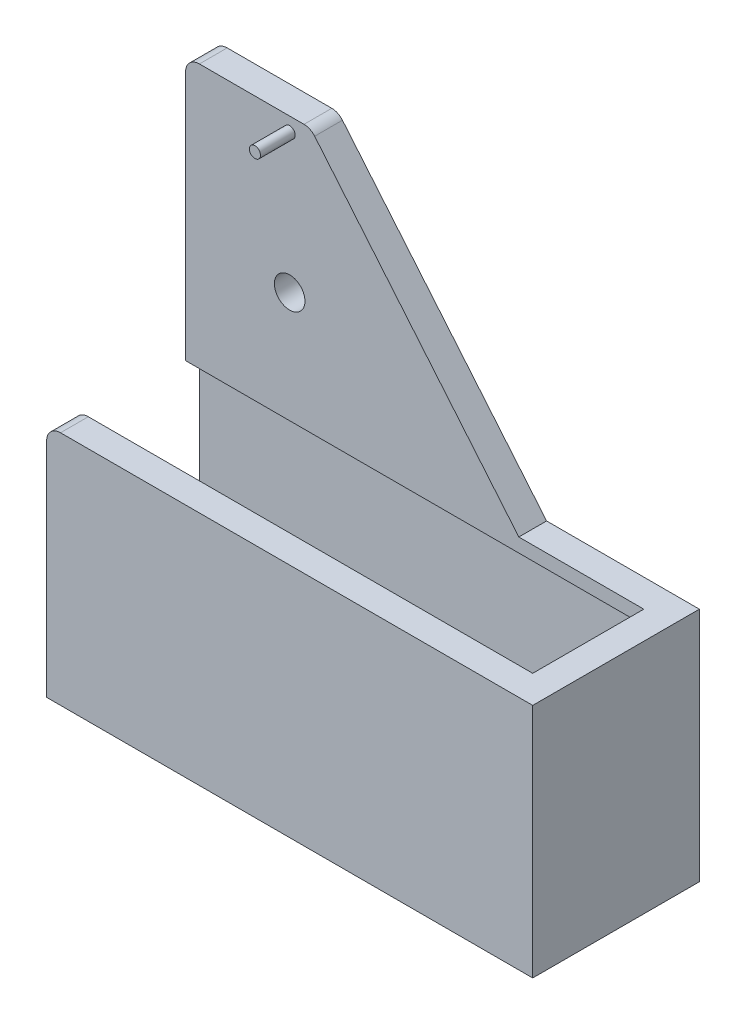
from build123d import *

# Parameters (mm, degrees)
SKETCH1_W           = 330
SKETCH1_H           = 120
BOSS_EXTRUDE1_DEPTH = 120
SKETCH2_W           = 100
SKETCH2_H           = 100
CUT_EXTRUDE1_DEPTH  = 357.230262611
CUT_EXTRUDE2_REACH  = 214.662
SKETCH5_W           = 330
SKETCH5_H           = 80
SKETCH6_W           = 40
SKETCH6_H           = 20
BOSS_EXTRUDE2_DEPTH = 180
SKETCH9_R           = 4
BOSS_EXTRUDE3_DEPTH = 25
SKETCH11_W          = 20
SKETCH11_H          = 120
EXTRUDE_THIN1_DEPTH = 120
CUT_EXTRUDE3_REACH  = 359.526
SKETCH12_W          = 30
SKETCH12_H          = 100
EXTRUDE_THIN2_DEPTH = 50
BOSS_EXTRUDE5_DEPTH = 20
FILLET1_R           = 10
SKETCH9_4_R         = 11
CUT_EXTRUDE4_DEPTH  = 367.367302034
SKETCH17_W          = 50
SKETCH17_H          = 20
BOSS_EXTRUDE6_DEPTH = 180
FILLET6_R           = 10


with BuildPart() as part:
    # Sketch1 → Boss-Extrude1 (new body)
    with BuildSketch(Plane(origin=(0, 0, 0), x_dir=(1, 0, 0), z_dir=(0, 1, 0))):
        Rectangle(SKETCH1_W, SKETCH1_H)
    extrude(amount=BOSS_EXTRUDE1_DEPTH)

    # Sketch2 → Cut-Extrude1 (cut, through all)
    with BuildSketch(Plane(origin=(165, 0, 0), x_dir=(0, 0, -1), z_dir=(1, 0, 0))):
        with Locations((0, 60)):
            Rectangle(SKETCH2_W, SKETCH2_H)
    extrude(amount=-CUT_EXTRUDE1_DEPTH, mode=Mode.SUBTRACT)

    # Sketch5 → Cut-Extrude2 (cut, up to next)
    with BuildSketch(Plane(origin=(0, 120, 0), x_dir=(1, 0, 0), z_dir=(0, 1, 0)), mode=Mode.PRIVATE) as cut_extrude2_sk1:
        Rectangle(SKETCH5_W, SKETCH5_H)
    cut_extrude2_tool1 = extrude(cut_extrude2_sk1.sketch, amount=-CUT_EXTRUDE2_REACH, mode=Mode.PRIVATE) & part.part
    add(cut_extrude2_tool1.solids().sort_by_distance((0, 120, 0))[0], mode=Mode.SUBTRACT)

    # Sketch6 → Boss-Extrude2 (add)
    with BuildSketch(Plane(origin=(0, 120, 0), x_dir=(1, 0, 0), z_dir=(0, 1, 0))):
        with Locations((-95, 50)):
            Rectangle(SKETCH6_W, SKETCH6_H)
    extrude(amount=BOSS_EXTRUDE2_DEPTH)

    # Sketch9 → Boss-Extrude3 (add)
    with BuildSketch(Plane.XY.offset(-40)):
        with Locations(Location((-90, 290, 0), (0, 0, 180))):
            Circle(SKETCH9_R)
    extrude(amount=BOSS_EXTRUDE3_DEPTH)

    # Sketch11 → Extrude-Thin1 (add, through all)
    with BuildSketch(Plane(origin=(0, 120, 0), x_dir=(1, 0, 0), z_dir=(0, 1, 0))):
        with Locations((175, 0)):
            Rectangle(SKETCH11_W, SKETCH11_H)
    extrude(amount=-EXTRUDE_THIN1_DEPTH)

    # Sketch12 → Cut-Extrude3 (cut, up to next)
    with BuildSketch(Plane.XZ, mode=Mode.PRIVATE) as cut_extrude3_sk1:
        with Locations((150, 0)):
            Rectangle(SKETCH12_W, SKETCH12_H)
    cut_extrude3_tool1 = extrude(cut_extrude3_sk1.sketch, amount=-CUT_EXTRUDE3_REACH, mode=Mode.PRIVATE) & part.part
    add(cut_extrude3_tool1.solids().sort_by_distance((150, 0, 0))[0], mode=Mode.SUBTRACT)

    # Sketch14 → Extrude-Thin2 (add)
    with BuildSketch(Plane.XZ):
        Polygon((-165, -60), (185, -60), (185, 60), (-165, 60), (-165, 50), (175, 50), (175, -50), (-165, -50), align=None)
    extrude(amount=EXTRUDE_THIN2_DEPTH)

    # Sketch16 → Boss-Extrude5 (add, through all)
    with BuildSketch(Plane.XY.offset(-40)):
        Polygon((-75, 300), (75, 120), (-75, 120), align=None)
    extrude(amount=-BOSS_EXTRUDE5_DEPTH)

    # Fillet1
    fillet1_edges = [part.edges().sort_by_distance(p)[0] for p in [
        (-75, 300, -50),
    ]]
    fillet(fillet1_edges, radius=FILLET1_R)

    # Sketch9<4> → Cut-Extrude4 (cut, through all)
    with BuildSketch(Plane.XY.offset(-40)):
        with Locations((-90, 190)):
            Circle(SKETCH9_4_R)
    extrude(amount=-CUT_EXTRUDE4_DEPTH, mode=Mode.SUBTRACT)

    # Sketch17 → Boss-Extrude6 (add, through all)
    with BuildSketch(Plane(origin=(0, 120, 0), x_dir=(1, 0, 0), z_dir=(0, 1, 0))):
        with Locations((-140, 50)):
            Rectangle(SKETCH17_W, SKETCH17_H)
    extrude(amount=BOSS_EXTRUDE6_DEPTH)

    # Fillet6
    fillet6_edges = [part.edges().sort_by_distance(p)[0] for p in [
        (-165, 120, 50),
        (-165, 300, -50),
    ]]
    fillet(fillet6_edges, radius=FILLET6_R)


solid = part.part
